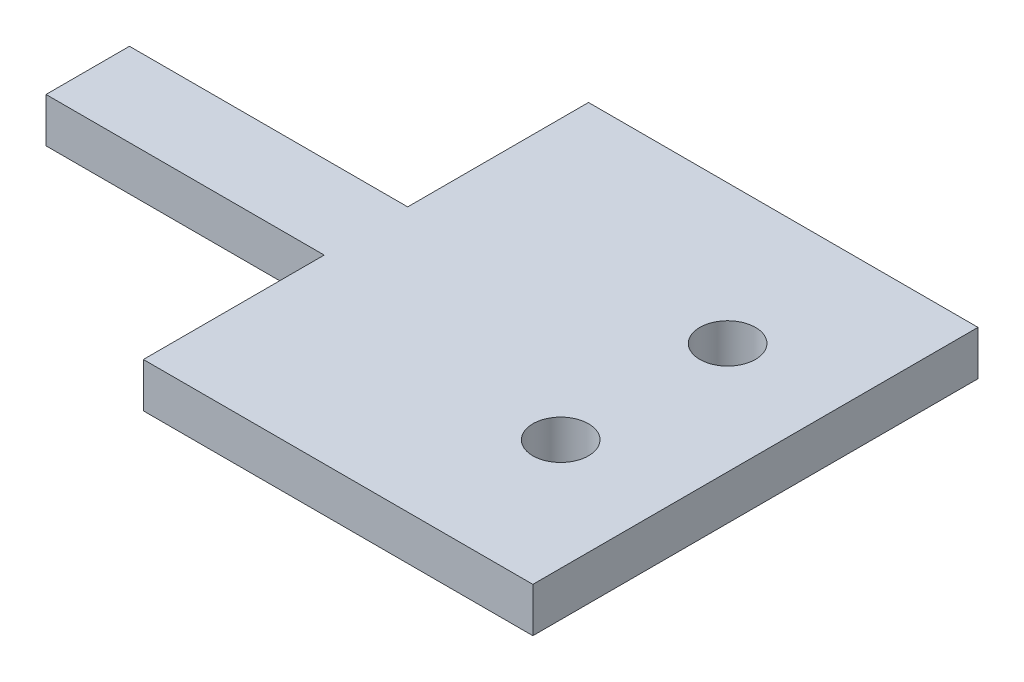
from build123d import *

# Parameters (mm, degrees)
SKETCH1_R           = 5
BOSS_EXTRUDE1_DEPTH = 8


with BuildPart() as part:
    # Sketch1 → Boss-Extrude1 (new body)
    with BuildSketch(Plane(origin=(0, 0, 0), x_dir=(1, 0, 0), z_dir=(0, 1, 0))):
        Polygon((60, -40), (60, 40), (-10, 40), (-10, 7.5), (-60, 7.5), (-60, -7.5), (-10, -7.5), (-10, -40), align=None)
        with Locations(Location((40, 15, 0), (0, 0, 270))):
            Circle(SKETCH1_R, mode=Mode.SUBTRACT)
        with Locations(Location((40, -15, 0), (0, 0, 270))):
            Circle(SKETCH1_R, mode=Mode.SUBTRACT)
    extrude(amount=BOSS_EXTRUDE1_DEPTH)


solid = part.part
